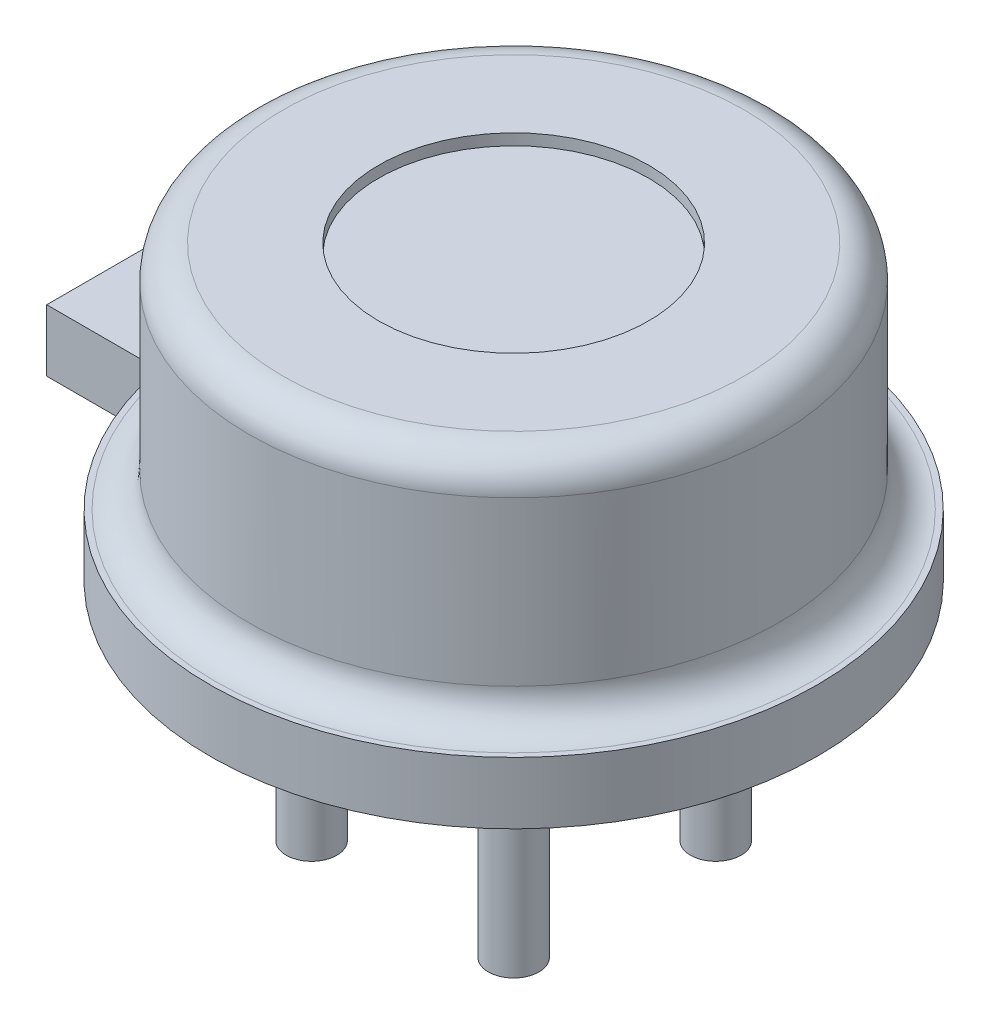
from build123d import *

# Parameters (mm, degrees)
SKETCH1_R           = 2.35
BOSS_EXTRUDE1_DEPTH = 2.6
SKETCH2_R           = 2.7
BOSS_EXTRUDE2_DEPTH = 0.55
FILLET1_R           = 0.3
FILLET2_R           = 0.3
SKETCH3_R           = 1.2
CUT_EXTRUDE1_DEPTH  = 0.1
SKETCH4_W           = 1.15
SKETCH4_H           = 1
BOSS_EXTRUDE3_DEPTH = 0.55
SKETCH5_R           = 0.225
BOSS_EXTRUDE4_DEPTH = 2


with BuildPart() as part:
    # Sketch1 → Boss-Extrude1 (new body)
    with BuildSketch(Plane(origin=(0, 0, 0), x_dir=(1, 0, 0), z_dir=(0, 1, 0))):
        with Locations(Location((0, 0, 0), (0, 0, 270))):
            Circle(SKETCH1_R)
    extrude(amount=BOSS_EXTRUDE1_DEPTH)

    # Sketch2 → Boss-Extrude2 (add)
    with BuildSketch(Plane.XZ):
        with Locations(Location((0, 0, 0), (0, 0, 270))):
            Circle(SKETCH2_R)
    extrude(amount=-BOSS_EXTRUDE2_DEPTH)

    # Fillet1
    fillet1_edges = [part.edges().sort_by_distance(p)[0] for p in [
        (0, 0.55, -2.35),
    ]]
    fillet(fillet1_edges, radius=FILLET1_R)

    # Fillet2
    fillet2_edges = [part.edges().sort_by_distance(p)[0] for p in [
        (0, 2.6, -2.35),
    ]]
    fillet(fillet2_edges, radius=FILLET2_R)

    # Sketch3 → Cut-Extrude1 (cut)
    with BuildSketch(Plane(origin=(0, 2.6, 0), x_dir=(1, 0, 0), z_dir=(0, 1, 0))):
        with Locations(Location((0, 0, 0), (0, 0, 270))):
            Circle(SKETCH3_R)
    extrude(amount=-CUT_EXTRUDE1_DEPTH, mode=Mode.SUBTRACT)

    # Sketch4 → Boss-Extrude3 (add)
    with BuildSketch(Plane.XZ):
        with Locations((-3.075, 0)):
            Rectangle(SKETCH4_W, SKETCH4_H)
    extrude(amount=-BOSS_EXTRUDE3_DEPTH)

    # Sketch5 → Boss-Extrude4 (add)
    with BuildSketch(Plane.XZ):
        with Locations(Location((-0.898025612, 0.898025612, 0), (0, 0, 90))):
            Circle(SKETCH5_R)
        with Locations(Location((0.898025612, 0.898025612, 0), (0, 0, 90))):
            Circle(SKETCH5_R)
        with Locations(Location((-0.898025612, -0.898025612, 0), (0, 0, 90))):
            Circle(SKETCH5_R)
        with Locations(Location((0.898025612, -0.898025612, 0), (0, 0, 90))):
            Circle(SKETCH5_R)
    extrude(amount=BOSS_EXTRUDE4_DEPTH)


solid = part.part
